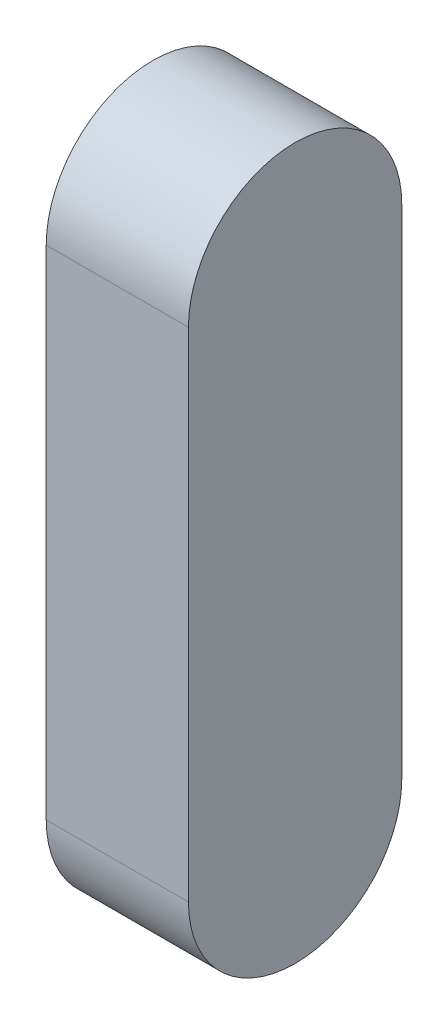
from build123d import *

# Parameters (mm, degrees)
EXTRUDE_1_DEPTH = 20


with BuildPart() as part:
    # 草图1 → 凸台-拉伸1 (new body)
    with BuildSketch(Plane(origin=(0, 0, 0), x_dir=(0, 0, -1), z_dir=(1, 0, 0))):
        with BuildLine():
            Line((15, 0), (15, -70))
            ThreePointArc((15, -70), (0, -85), (-15, -70))
            Line((-15, -70), (-15, 0))
            ThreePointArc((-15, 0), (0, 15), (15, 0))
        make_face()
    extrude(amount=EXTRUDE_1_DEPTH)


solid = part.part
